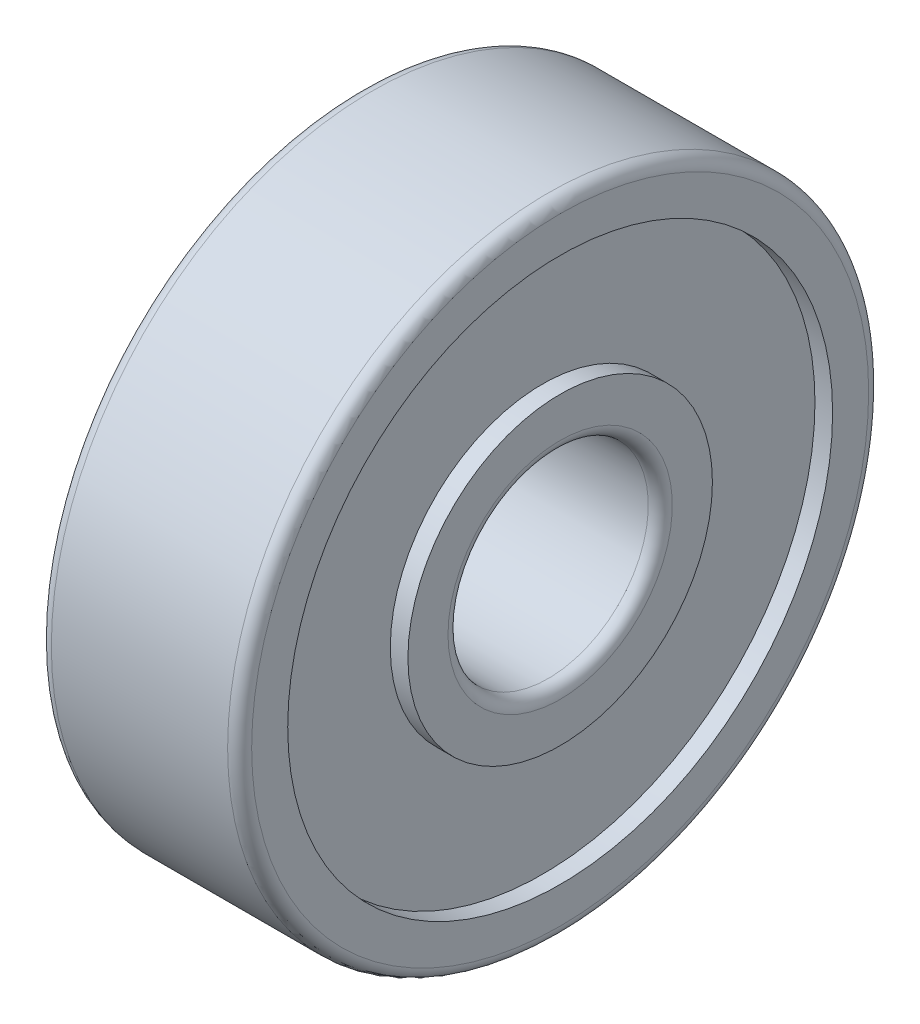
from build123d import *


with BuildPart() as part:
    # Sketch1 → Revolve1 (revolve)
    with BuildSketch(Plane.XY, mode=Mode.PRIVATE) as revolve1_sk:
        with BuildLine():
            Line((0, 7.7), (0, 6.8))
            Line((0, 6.8), (0.44, 6.8))
            Line((0.44, 6.8), (0.44, 3.8))
            Line((0.44, 3.8), (0, 3.8))
            Line((0, 3.8), (0, 2.8))
            ThreePointArc((0, 2.8), (0.087867966, 2.587867966), (0.3, 2.5))
            Line((0.3, 2.5), (4.7, 2.5))
            ThreePointArc((4.7, 2.5), (4.912132034, 2.587867966), (5, 2.8))
            Line((5, 2.8), (5, 3.8))
            Line((5, 3.8), (4.56, 3.8))
            Line((4.56, 3.8), (4.56, 6.8))
            Line((4.56, 6.8), (5, 6.8))
            Line((5, 6.8), (5, 7.7))
            ThreePointArc((5, 7.7), (4.912132034, 7.912132034), (4.7, 8))
            Line((4.7, 8), (0.3, 8))
            ThreePointArc((0.3, 8), (0.087867966, 7.912132034), (0, 7.7))
        make_face()
    revolve(revolve1_sk.sketch.rotate(Axis((4.7, 0, 0), (-1, 0, 0)), 270), axis=Axis((4.7, 0, 0), (-1, 0, 0)))


solid = part.part
